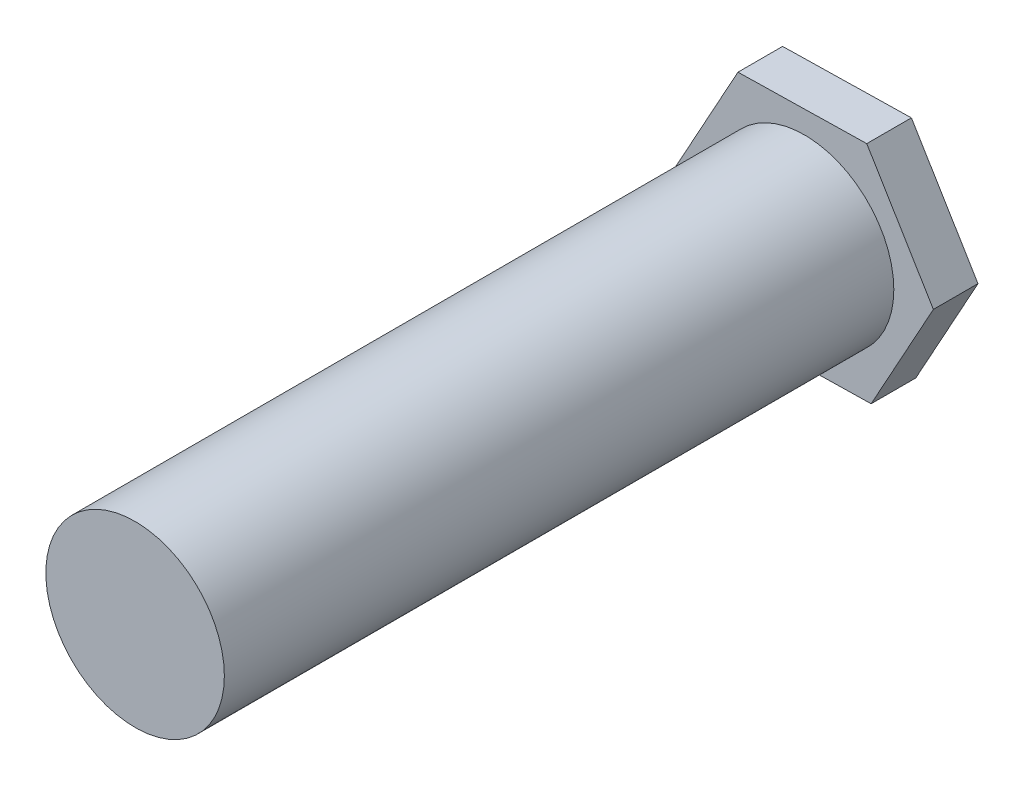
from build123d import *

# Parameters (mm, degrees)
BOSS_EXTRUDE1_DEPTH = 12.7
SKETCH2_R           = 25.4
BOSS_EXTRUDE2_DEPTH = 190.5


with BuildPart() as part:
    # Sketch1 → Boss-Extrude1 (new body)
    with BuildSketch(Plane.XY):
        Polygon((17.703864828, 32.103839389), (-18.950808056, 31.38391638), (-36.654672883, -0.719923008), (-17.703864828, -32.103839389), (18.950808056, -31.38391638), (36.654672883, 0.719923008), align=None)
    extrude(amount=BOSS_EXTRUDE1_DEPTH)

    # Sketch2 → Boss-Extrude2 (add)
    with BuildSketch(Plane.XY.offset(12.7)):
        Circle(SKETCH2_R)
    extrude(amount=BOSS_EXTRUDE2_DEPTH)


solid = part.part
